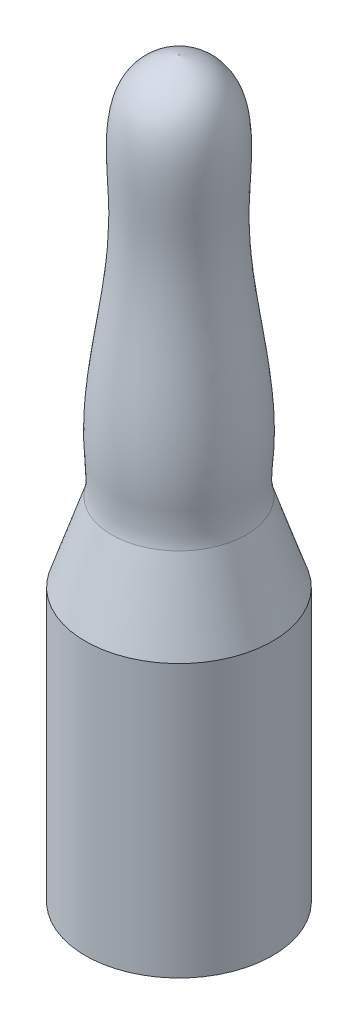
from build123d import *


with BuildPart() as part:
    # ｽｹｯﾁ3 → 回転1 (revolve)
    with BuildSketch(Plane.XY, mode=Mode.PRIVATE) as revolve_1_sk:
        with BuildLine():
            Line((0, 0), (0, 632))
            add(Edge.make_bspline(
                [(0, 632), (55.150357326, 621.151087312), (27.526884799, 490.9520236), (65.128155072, 385.952190655), (55.465982064, 313.372444948), (58, 302.842898064)],
                knots=[0, 0, 0, 0, 0.383406216, 0.907950927, 1, 1, 1, 1], degree=3))
            Line((58, 302.842898064), (80.732484076, 234.792716425))
            Line((80.732484076, 234.792716425), (80.732484076, 0))
            Line((80.732484076, 0), (0, 0))
        make_face()
    revolve(revolve_1_sk.sketch.rotate(Axis((0, 0, 0), (0, 1, 0)), 90), axis=Axis((0, 0, 0), (0, 1, 0)))


solid = part.part
